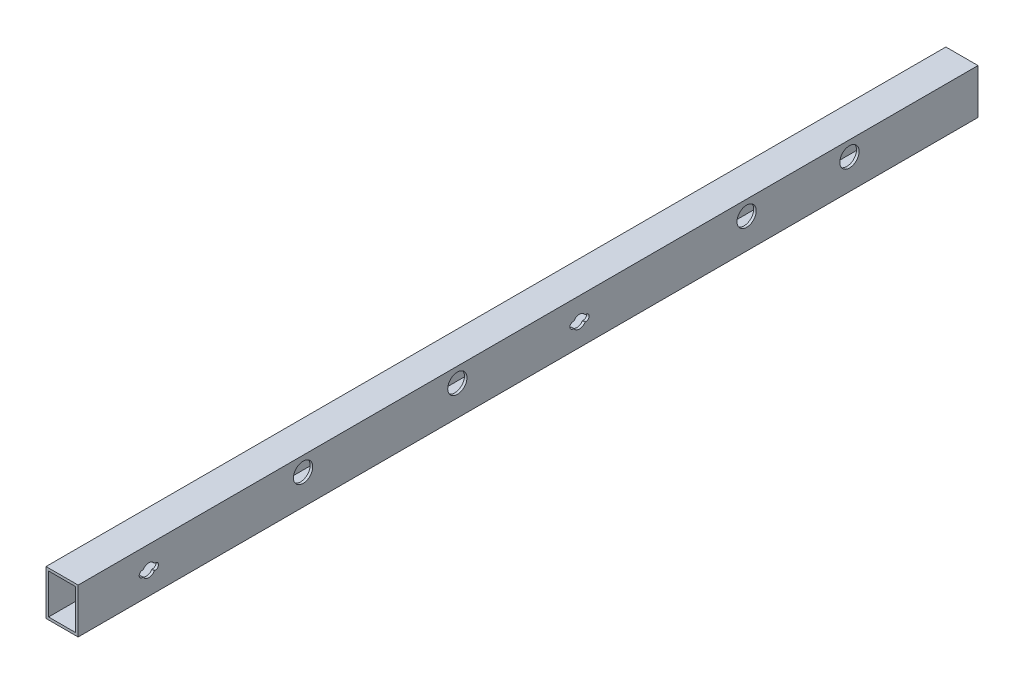
from build123d import *

# Parameters (mm, degrees)
SKETCH1_W           = 50
SKETCH1_H           = 70
SKETCH1_W_2         = 42
SKETCH1_H_2         = 62
BOSS_EXTRUDE2_DEPTH = 1400
SKETCH2_R           = 15
CUT_EXTRUDE1_DEPTH  = 1403.640367307


with BuildPart() as part:
    # Sketch1 → Boss-Extrude2 (new body)
    with BuildSketch(Plane.XY):
        with Locations((25, -35)):
            Rectangle(SKETCH1_W, SKETCH1_H)
        with Locations((25, -35)):
            Rectangle(SKETCH1_W_2, SKETCH1_H_2, mode=Mode.SUBTRACT)
    extrude(amount=BOSS_EXTRUDE2_DEPTH)

    # Sketch2 → Cut-Extrude1 (cut, through all)
    with BuildSketch(Plane(origin=(50, 0, 0), x_dir=(0, 0, -1), z_dir=(1, 0, 0))):
        with Locations(Location((-1050, -23, 0), (0, 0, 90))):
            Circle(SKETCH2_R)
        with Locations(Location((-200, -23, 0), (0, 0, 90))):
            Circle(SKETCH2_R)
        with Locations(Location((-810, -23, 0), (0, 0, 90))):
            Circle(SKETCH2_R)
        with Locations(Location((-360, -23, 0), (0, 0, 90))):
            Circle(SKETCH2_R)
        with BuildLine():
            Line((-1281.339745962, -30), (-1280, -30))
            ThreePointArc((-1280, -30), (-1275, -35), (-1280, -40))
            Line((-1280, -40), (-1281.339745962, -40))
            ThreePointArc((-1281.339745962, -40), (-1290, -45), (-1298.660254038, -40))
            Line((-1298.660254038, -40), (-1300, -40))
            ThreePointArc((-1300, -40), (-1305, -35), (-1300, -30))
            Line((-1300, -30), (-1298.660254038, -30))
            ThreePointArc((-1298.660254038, -30), (-1290, -25), (-1281.339745962, -30))
        make_face()
        with BuildLine():
            Line((-611.339745962, -30), (-610, -30))
            ThreePointArc((-610, -30), (-605, -35), (-610, -40))
            Line((-610, -40), (-611.339745962, -40))
            ThreePointArc((-611.339745962, -40), (-620, -45), (-628.660254038, -40))
            Line((-628.660254038, -40), (-630, -40))
            ThreePointArc((-630, -40), (-635, -35), (-630, -30))
            Line((-630, -30), (-628.660254038, -30))
            ThreePointArc((-628.660254038, -30), (-620, -25), (-611.339745962, -30))
        make_face()
    extrude(amount=-CUT_EXTRUDE1_DEPTH, mode=Mode.SUBTRACT)


solid = part.part
